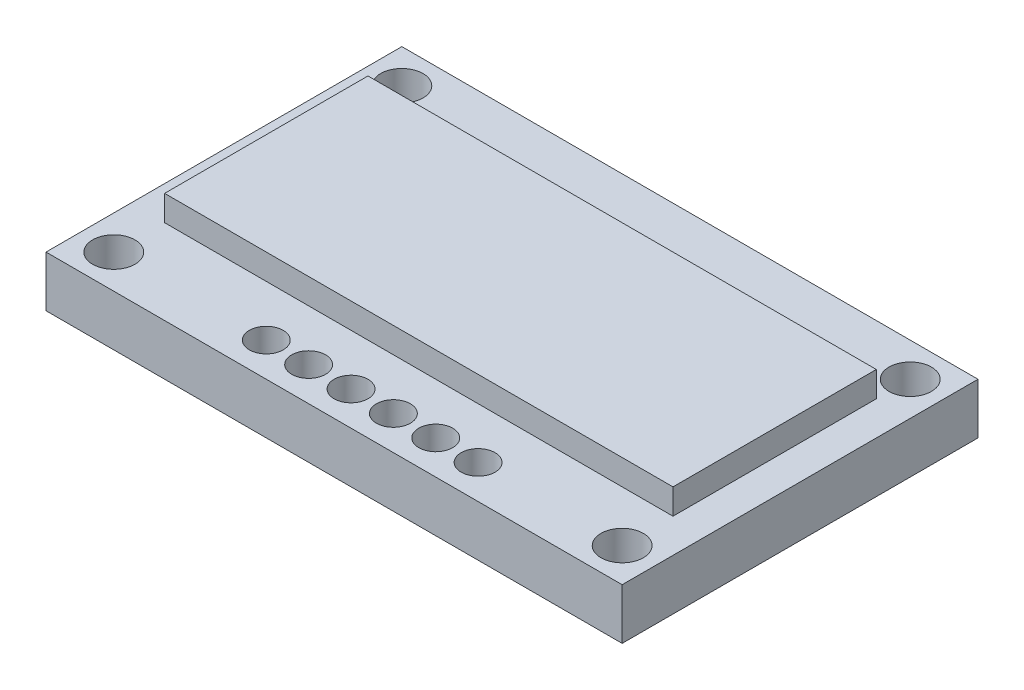
from build123d import *

# Parameters (mm, degrees)
ESQUISSE1_W             = 34
ESQUISSE1_H             = 21
BOSS_EXTRU_1_DEPTH      = 3
ESQUISSE2_W             = 30
ESQUISSE2_H             = 12
BOSS_EXTRU_2_DEPTH      = 1.5
ESQUISSE3_R             = 1
ESQUISSE3_R_2           = 1.25
ENL_V_MAT_EXTRU_1_DEPTH = 5


with BuildPart() as part:
    # Esquisse1 → Boss.-Extru.1 (new body)
    with BuildSketch(Plane(origin=(0, 0, 0), x_dir=(1, 0, 0), z_dir=(0, 1, 0))):
        with Locations((17, 10.5)):
            Rectangle(ESQUISSE1_W, ESQUISSE1_H)
    extrude(amount=BOSS_EXTRU_1_DEPTH)

    # Esquisse2 → Boss.-Extru.2 (add)
    with BuildSketch(Plane(origin=(0, 3, 0), x_dir=(1, 0, 0), z_dir=(0, 1, 0))):
        with Locations((17, 11)):
            Rectangle(ESQUISSE2_W, ESQUISSE2_H)
    extrude(amount=BOSS_EXTRU_2_DEPTH)

    # Esquisse3 → Enlèv. mat.-Extru.1 (cut)
    with BuildSketch(Plane(origin=(0, 3, 0), x_dir=(1, 0, 0), z_dir=(0, 1, 0))):
        with Locations(Location((11, 2, 0), (0, 0, 270))):
            Circle(ESQUISSE3_R)
        with Locations(Location((13.5, 2, 0), (0, 0, 270))):
            Circle(ESQUISSE3_R)
        with Locations(Location((16, 2, 0), (0, 0, 270))):
            Circle(ESQUISSE3_R)
        with Locations(Location((18.5, 2, 0), (0, 0, 270))):
            Circle(ESQUISSE3_R)
        with Locations(Location((21, 2, 0), (0, 0, 270))):
            Circle(ESQUISSE3_R)
        with Locations(Location((23.5, 2, 0), (0, 0, 270))):
            Circle(ESQUISSE3_R)
        with Locations(Location((2, 2, 0), (0, 0, 270))):
            Circle(ESQUISSE3_R_2)
        with Locations(Location((2, 19, 0), (0, 0, 270))):
            Circle(ESQUISSE3_R_2)
        with Locations(Location((32, 19, 0), (0, 0, 270))):
            Circle(ESQUISSE3_R_2)
        with Locations(Location((32, 2, 0), (0, 0, 270))):
            Circle(ESQUISSE3_R_2)
    extrude(amount=-ENL_V_MAT_EXTRU_1_DEPTH, mode=Mode.SUBTRACT)


solid = part.part
